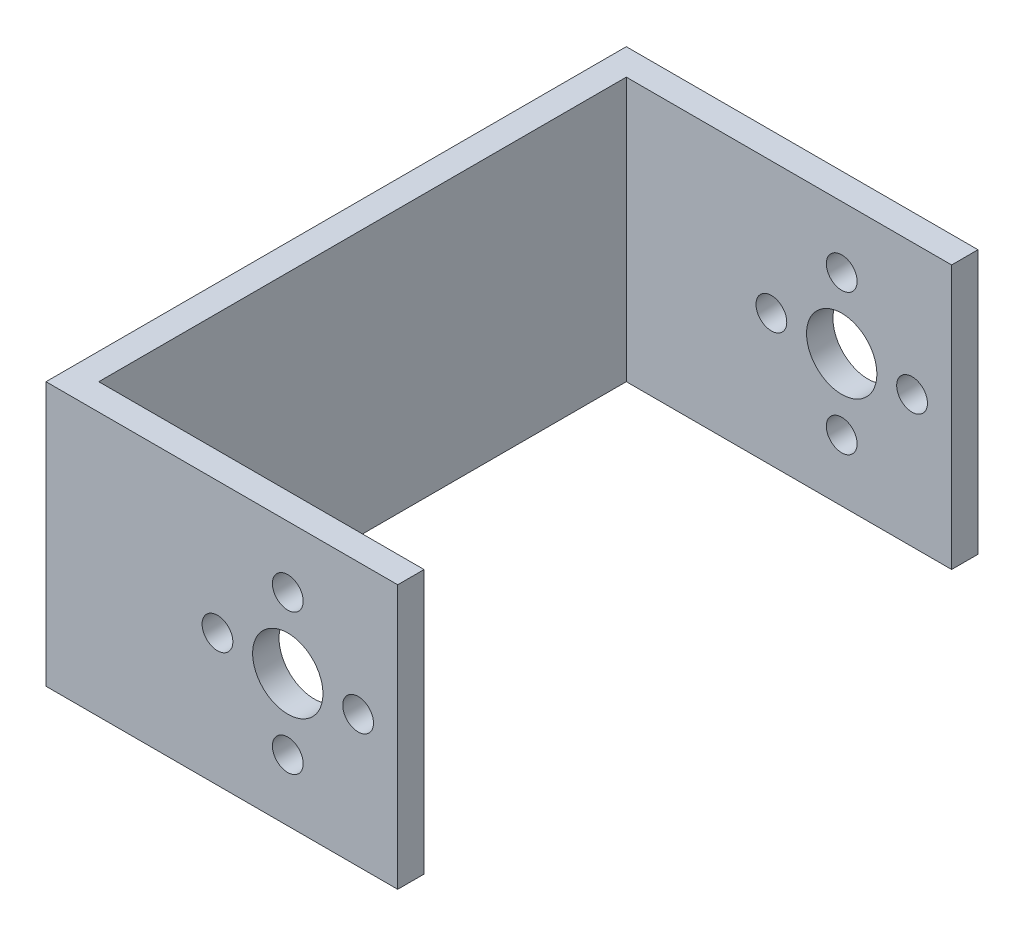
from build123d import *

# Parameters (mm, degrees)
BOSS_EXTRUDE1_DEPTH = 30
SKETCH2_R           = 4
SKETCH2_R_2         = 1.75
CUT_EXTRUDE1_DEPTH  = 83.800966178


with BuildPart() as part:
    # Sketch1 → Boss-Extrude1 (new body)
    with BuildSketch(Plane(origin=(0, 0, 0), x_dir=(1, 0, 0), z_dir=(0, 1, 0))):
        Polygon((0, 0), (0, 66), (40, 66), (40, 63), (3, 63), (3, 3), (40, 3), (40, 0), align=None)
    extrude(amount=BOSS_EXTRUDE1_DEPTH)

    # Sketch2 → Cut-Extrude1 (cut, through all)
    with BuildSketch(Plane.XY):
        with Locations((27.5, 15)):
            Circle(SKETCH2_R)
        with Locations((19.5, 15)):
            Circle(SKETCH2_R_2)
        with Locations((27.5, 23)):
            Circle(SKETCH2_R_2)
        with Locations((35.5, 15)):
            Circle(SKETCH2_R_2)
        with Locations((27.5, 7)):
            Circle(SKETCH2_R_2)
    extrude(amount=-CUT_EXTRUDE1_DEPTH, mode=Mode.SUBTRACT)


solid = part.part
